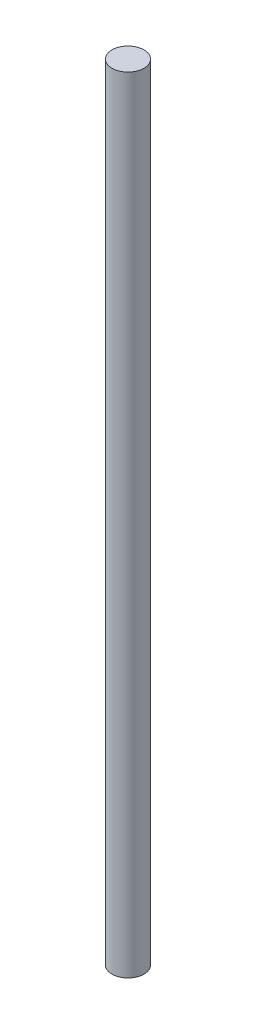
from build123d import *

# Parameters (mm, degrees)
SKETCH2_R           = 0.815
BOSS_EXTRUDE1_DEPTH = 40


with BuildPart() as part:
    # Sketch2 → Boss-Extrude1 (new body)
    with BuildSketch(Plane(origin=(0, 0, 0), x_dir=(1, 0, 0), z_dir=(0, 1, 0))):
        with Locations(Location((0, 0, 0), (0, 0, 270))):
            Circle(SKETCH2_R)
    extrude(amount=BOSS_EXTRUDE1_DEPTH)


solid = part.part
